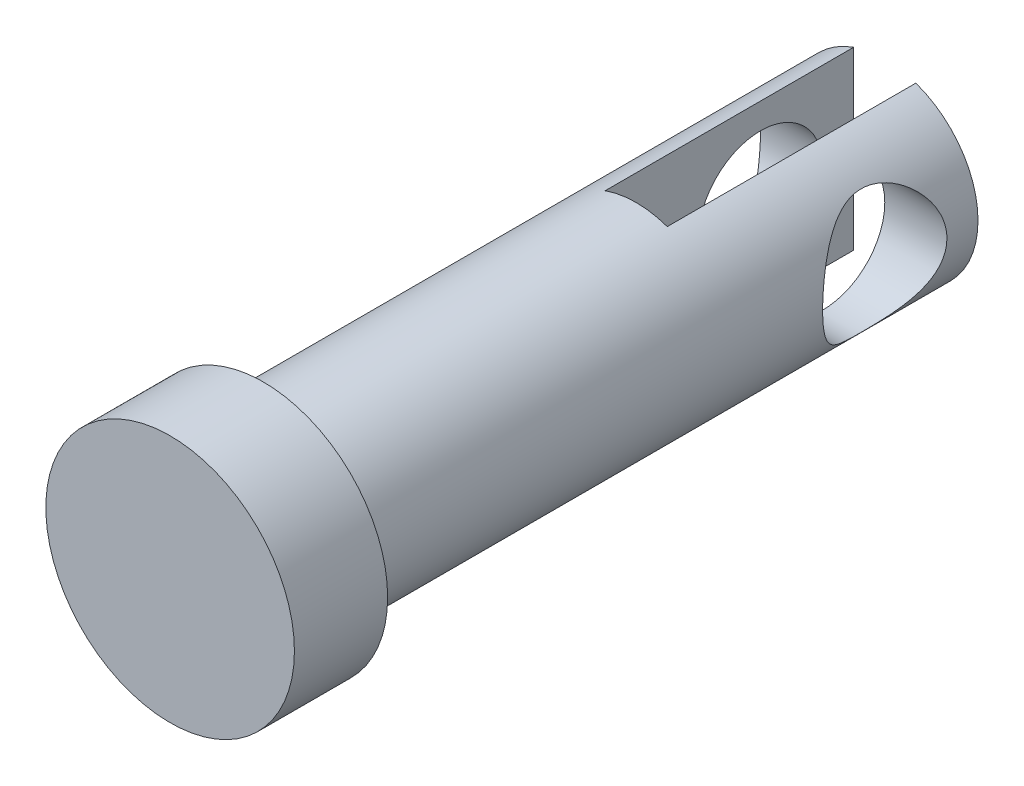
from build123d import *

# Parameters (mm, degrees)
SKETCH_1_R          = 3
EXTRUDE_1_DEPTH     = 20
SKETCH_2_R          = 4
EXTRUDE_2_DEPTH     = 3
SKETCH_4_W          = 2
SKETCH_4_H          = 6.835299346
CUT_EXTRUDE_1_DEPTH = 8
SKETCH_5_R          = 2
CUT_EXTRUDE_2_DEPTH = 4


with BuildPart() as part:
    # 草图1 → 凸台-拉伸1 (new body)
    with BuildSketch(Plane.XY):
        Circle(SKETCH_1_R)
    extrude(amount=EXTRUDE_1_DEPTH)

    # 草图2 → 凸台-拉伸2 (add)
    with BuildSketch(Plane.XY.offset(20)):
        Circle(SKETCH_2_R)
    extrude(amount=EXTRUDE_2_DEPTH)

    # 草图4 → 切除-拉伸1 (cut)
    with BuildSketch(Plane(origin=(0, 0, 0), x_dir=(-1, 0, 0), z_dir=(0, 0, -1))):
        Rectangle(SKETCH_4_W, SKETCH_4_H)
    extrude(amount=-CUT_EXTRUDE_1_DEPTH, mode=Mode.SUBTRACT)

    # 草图5 → 切除-拉伸2 (cut, symmetric)
    with BuildSketch(Plane(origin=(0, 0, 0), x_dir=(0, 0, -1), z_dir=(1, 0, 0))):
        with Locations((-3, 0)):
            Circle(SKETCH_5_R)
    extrude(amount=CUT_EXTRUDE_2_DEPTH, both=True, mode=Mode.SUBTRACT)


solid = part.part
